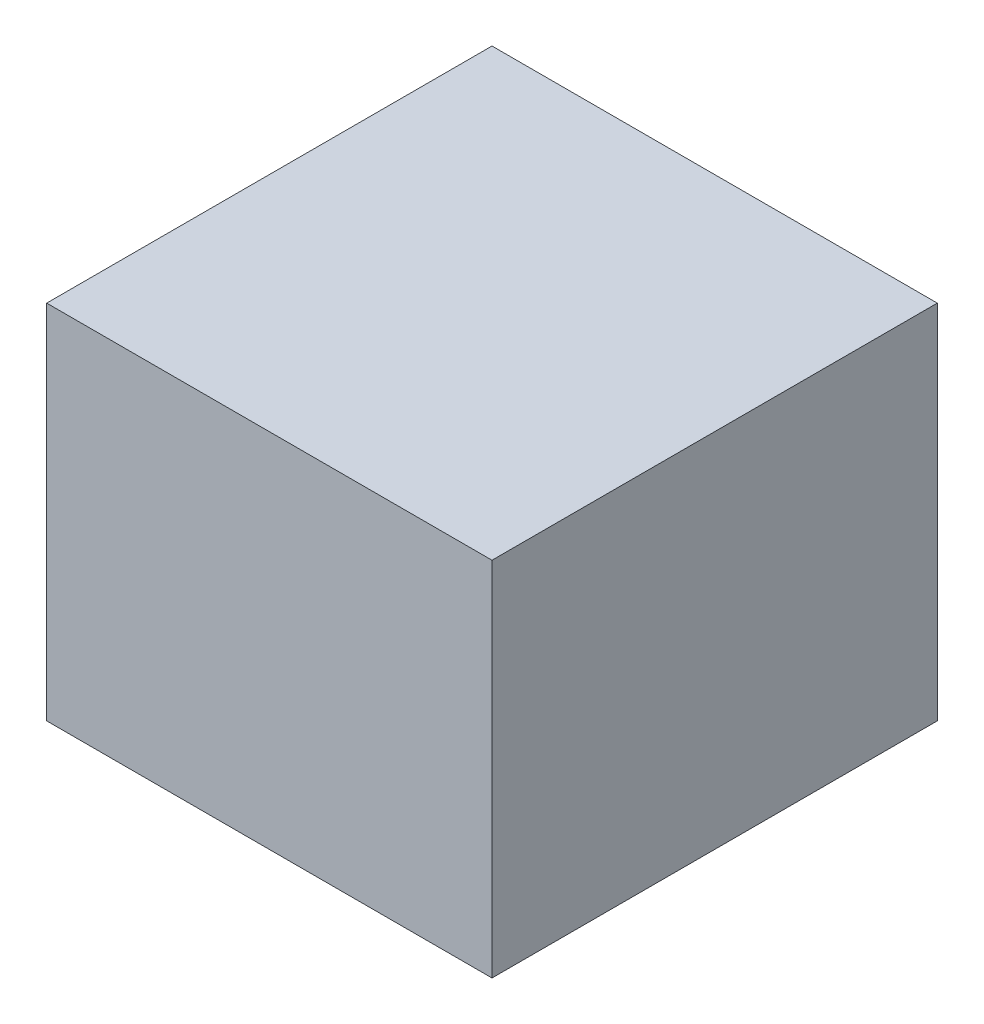
from build123d import *

# Parameters (mm, degrees)
SZKIC1_W                    = 8
SZKIC1_H                    = 8
DODANIE_WYCI_GNI_CIE1_DEPTH = 6.5


with BuildPart() as part:
    # Szkic1 → Dodanie-wyciągnięcie1 (new body)
    with BuildSketch(Plane(origin=(0, 0, 0), x_dir=(1, 0, 0), z_dir=(0, 1, 0))):
        Rectangle(SZKIC1_W, SZKIC1_H)
    extrude(amount=DODANIE_WYCI_GNI_CIE1_DEPTH)


solid = part.part
